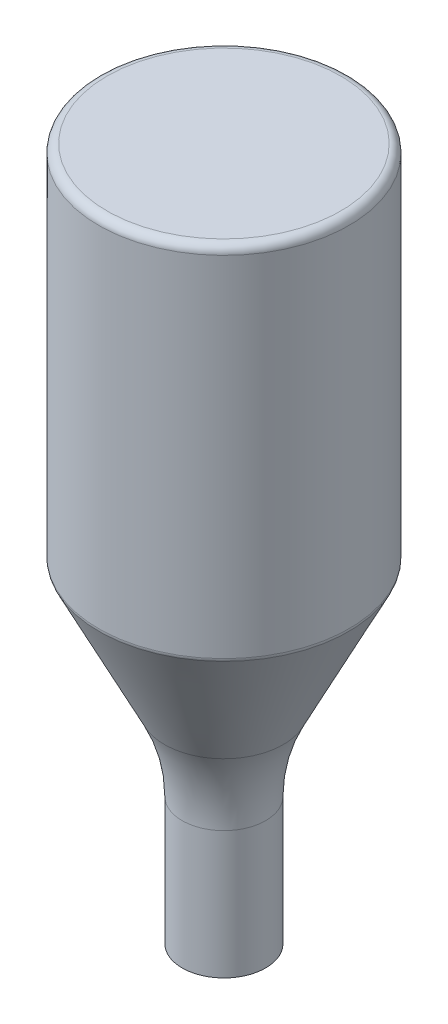
from build123d import *

# Parameters (mm, degrees)
SKETCH1_R          = 30.591778674
CUT_EXTRUDE1_DEPTH = 34
FILLET1_R          = 2


with BuildPart() as part:
    # Esquisse1 → Révolution1 (revolve)
    with BuildSketch(Plane.XY, mode=Mode.PRIVATE) as r_volution1_sk:
        with BuildLine():
            Line((0, 0), (28, 0))
            ThreePointArc((28, 0), (29.414213562, -0.585786438), (30, -2))
            Line((30, -2), (30, -119.627445758))
            ThreePointArc((30, -119.627445758), (29.957782489, -119.990033798), (29.833388678, -120.333222644))
            Line((29.833388678, -120.333222644), (14.22291236, -151.55417528))
            ThreePointArc((14.22291236, -151.55417528), (11.070040421, -160.252602278), (10, -169.4427191))
            Line((10, -169.4427191), (10, -200))
            Line((10, -200), (5, -200))
            Line((5, -200), (5, -170))
            Line((5, -170), (0, -170))
            Line((0, -170), (0, 0))
        make_face()
    revolve(r_volution1_sk.sketch.rotate(Axis((0, 0, 0), (0, -1, 0)), 180), axis=Axis((0, 0, 0), (0, -1, 0)))

    # Sketch1 → Cut-Extrude1 (cut)
    with BuildSketch(Plane(origin=(0, 0, 0), x_dir=(1, 0, 0), z_dir=(0, 1, 0))):
        Circle(SKETCH1_R)
    extrude(amount=-CUT_EXTRUDE1_DEPTH, mode=Mode.SUBTRACT)

    # Fillet1
    fillet1_edges = [part.edges().sort_by_distance(p)[0] for p in [
        (30, -34, 0),
    ]]
    fillet(fillet1_edges, radius=FILLET1_R)


solid = part.part
